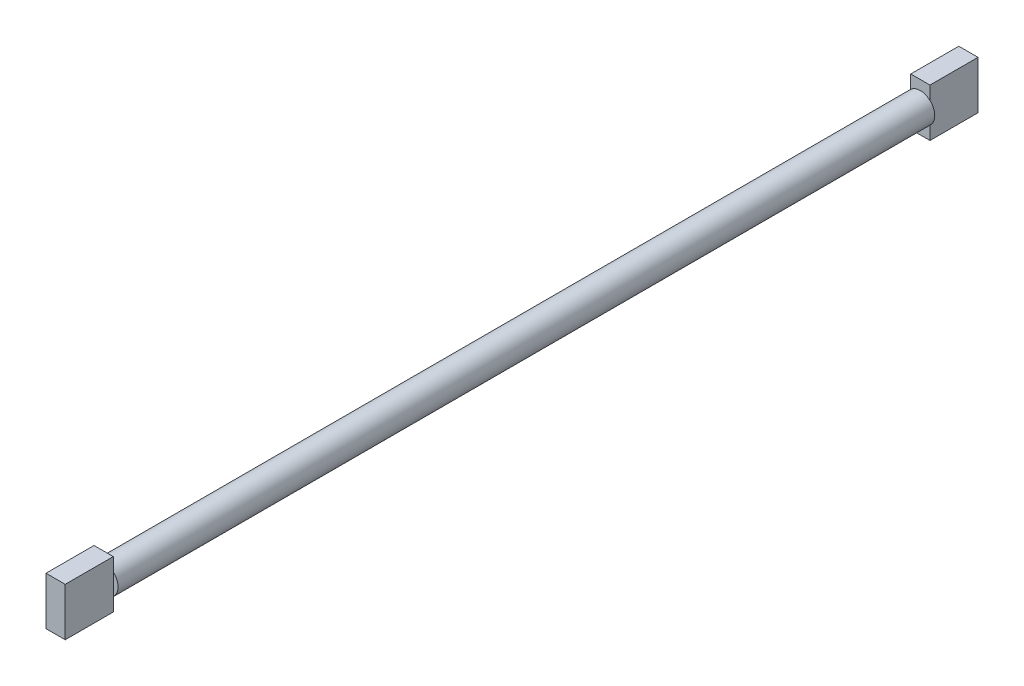
from build123d import *

# Parameters (mm, degrees)
SKETCH1_R           = 15
BOSS_EXTRUDE1_DEPTH = 850
SKETCH3_W           = 20
SKETCH3_H           = 50
BOSS_EXTRUDE2_DEPTH = 50


with BuildPart() as part:
    # Sketch1 → Boss-Extrude1 (new body)
    with BuildSketch(Plane.XY):
        Circle(SKETCH1_R)
    extrude(amount=BOSS_EXTRUDE1_DEPTH)

    # Sketch3 → Boss-Extrude2 (add)
    with BuildSketch(Plane.XY.offset(850)):
        Rectangle(SKETCH3_W, SKETCH3_H)
    boss_extrude2 = extrude(amount=BOSS_EXTRUDE2_DEPTH)

    # Mirror1: Boss-Extrude2 across plane
    add(boss_extrude2.mirror(Plane(origin=(0, 0, 425), x_dir=(1, 0, 0), z_dir=(0, 0, -1))))


solid = part.part
